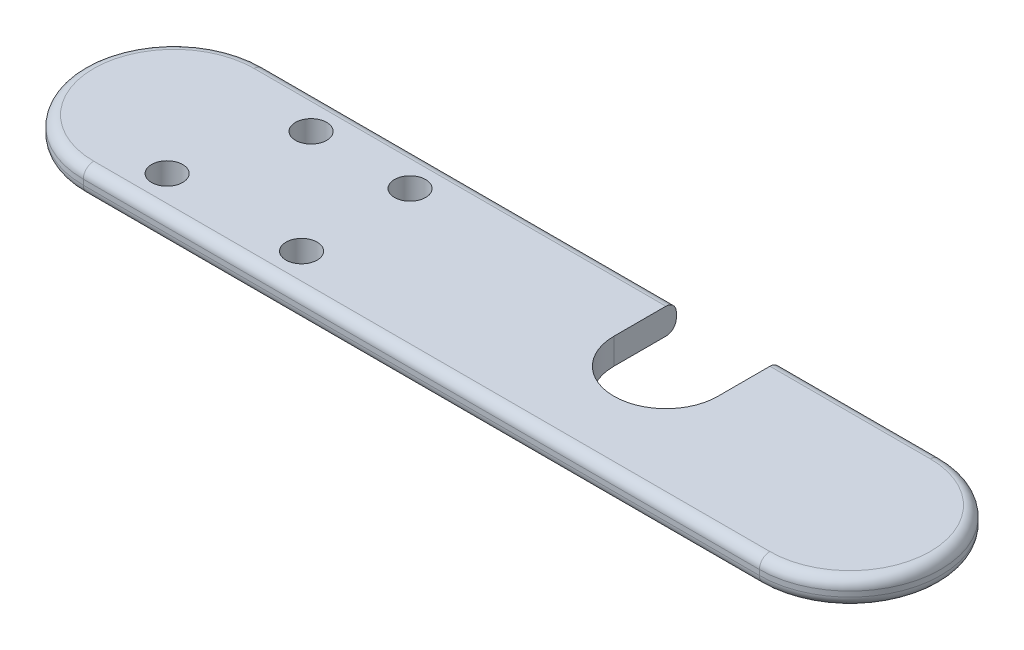
from build123d import *

# Parameters (mm, degrees)
BOSS_EXTRUDE1_DEPTH = 2.5
CUT_EXTRUDE1_REACH  = 86.406
SKETCH2_R           = 3
FILLET1_R           = 2
CUT_EXTRUDE2_DEPTH  = 10


with BuildPart() as part:
    # Sketch1 → Boss-Extrude1 (new, symmetric)
    with BuildSketch(Plane(origin=(0, 0, 0), x_dir=(1, 0, 0), z_dir=(0, 1, 0))):
        with BuildLine():
            Line((-65.005, 17.43), (65.005, 17.43))
            ThreePointArc((65.005, 17.43), (82.435, 0), (65.005, -17.43))
            Line((65.005, -17.43), (-65.005, -17.43))
            ThreePointArc((-65.005, -17.43), (-82.435, 0), (-65.005, 17.43))
        make_face()
    extrude(amount=BOSS_EXTRUDE1_DEPTH, both=True)

    # Sketch2 → Cut-Extrude1 (cut, up to next)
    with BuildSketch(Plane(origin=(0, 2.5, 0), x_dir=(1, 0, 0), z_dir=(0, 1, 0)), mode=Mode.PRIVATE) as cut_extrude1_sk1:
        with Locations(Location((-49.065, 10.43, 0), (0, 0, 270))):
            Circle(SKETCH2_R)
    cut_extrude1_tool1 = extrude(cut_extrude1_sk1.sketch, amount=-CUT_EXTRUDE1_REACH, mode=Mode.PRIVATE) & part.part
    # Sketch2 → Cut-Extrude1 (cut, up to next)
    with BuildSketch(Plane(origin=(0, 2.5, 0), x_dir=(1, 0, 0), z_dir=(0, 1, 0)), mode=Mode.PRIVATE) as cut_extrude1_sk2:
        with Locations(Location((-30.035, 10.43, 0), (0, 0, 270))):
            Circle(SKETCH2_R)
    cut_extrude1_tool2 = extrude(cut_extrude1_sk2.sketch, amount=-CUT_EXTRUDE1_REACH, mode=Mode.PRIVATE) & part.part
    # Sketch2 → Cut-Extrude1 (cut, up to next)
    with BuildSketch(Plane(origin=(0, 2.5, 0), x_dir=(1, 0, 0), z_dir=(0, 1, 0)), mode=Mode.PRIVATE) as cut_extrude1_sk3:
        with Locations(Location((-55.895, -10.43, 0), (0, 0, 270))):
            Circle(SKETCH2_R)
    cut_extrude1_tool3 = extrude(cut_extrude1_sk3.sketch, amount=-CUT_EXTRUDE1_REACH, mode=Mode.PRIVATE) & part.part
    # Sketch2 → Cut-Extrude1 (cut, up to next)
    with BuildSketch(Plane(origin=(0, 2.5, 0), x_dir=(1, 0, 0), z_dir=(0, 1, 0)), mode=Mode.PRIVATE) as cut_extrude1_sk4:
        with Locations(Location((-30.035, -10.43, 0), (0, 0, 270))):
            Circle(SKETCH2_R)
    cut_extrude1_tool4 = extrude(cut_extrude1_sk4.sketch, amount=-CUT_EXTRUDE1_REACH, mode=Mode.PRIVATE) & part.part
    add(cut_extrude1_tool1.solids().sort_by_distance((-49.065, 2.5, -10.43))[0], mode=Mode.SUBTRACT)
    add(cut_extrude1_tool2.solids().sort_by_distance((-30.035, 2.5, -10.43))[0], mode=Mode.SUBTRACT)
    add(cut_extrude1_tool3.solids().sort_by_distance((-55.895, 2.5, 10.43))[0], mode=Mode.SUBTRACT)
    add(cut_extrude1_tool4.solids().sort_by_distance((-30.035, 2.5, 10.43))[0], mode=Mode.SUBTRACT)

    # Fillet1
    fillet1_edges = [part.edges().sort_by_distance(p)[0] for p in [
        (82.435, 2.5, 0),
        (0, 2.5, -17.43),
        (-82.435, 2.5, 0),
        (0, -2.5, -17.43),
        (82.435, -2.5, 0),
        (0, -2.5, 17.43),
        (-82.435, -2.5, 0),
        (0, 2.5, 17.43),
    ]]
    fillet(fillet1_edges, radius=FILLET1_R)

    # Sketch3 → Cut-Extrude2 (cut)
    with BuildSketch(Plane(origin=(0, 2.5, 0), x_dir=(1, 0, 0), z_dir=(0, 1, 0))):
        with BuildLine():
            Line((34.165, 17.43), (34.165, 5.43))
            ThreePointArc((34.165, 5.43), (24.165, -4.57), (14.165, 5.43))
            Line((14.165, 5.43), (14.165, 17.43))
            Line((14.165, 17.43), (34.165, 17.43))
        make_face()
    extrude(amount=-CUT_EXTRUDE2_DEPTH, mode=Mode.SUBTRACT)


solid = part.part
